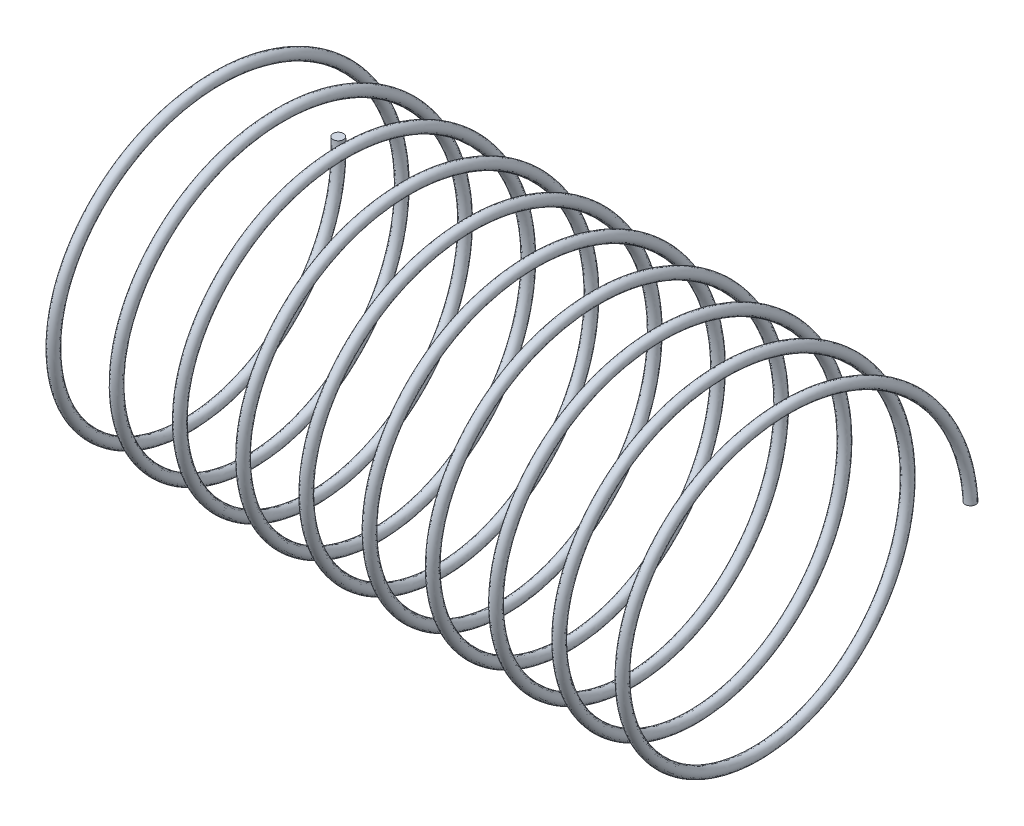
from build123d import *

# Parameters (mm, degrees)
SWEEP1_PITCH       = 1.2
SWEEP1_HEIGHT      = 12
SWEEP1_RADIUS      = 3
SWEEP1_START_ANGLE = -180
SKETCH4_R          = 0.1


with BuildPart() as part:
    # Sweep1: sweep along a helix
    with BuildLine() as sweep1_path:
        add(Helix(SWEEP1_PITCH, SWEEP1_HEIGHT, SWEEP1_RADIUS, center=(0, 0, 0), direction=(1, 0, 0), lefthand=True, mode=Mode.PRIVATE).rotate(Axis((0, 0, 0), (1, 0, 0)), SWEEP1_START_ANGLE))
    # Sketch4 → Sweep1 (sweep)
    with BuildSketch(Plane(origin=(0, 0, 0), x_dir=(1, 0, 0), z_dir=(0, 1, 0))):
        with Locations((0, 3)):
            Circle(SKETCH4_R)
    sweep(path=sweep1_path.line, is_frenet=True)


solid = part.part
